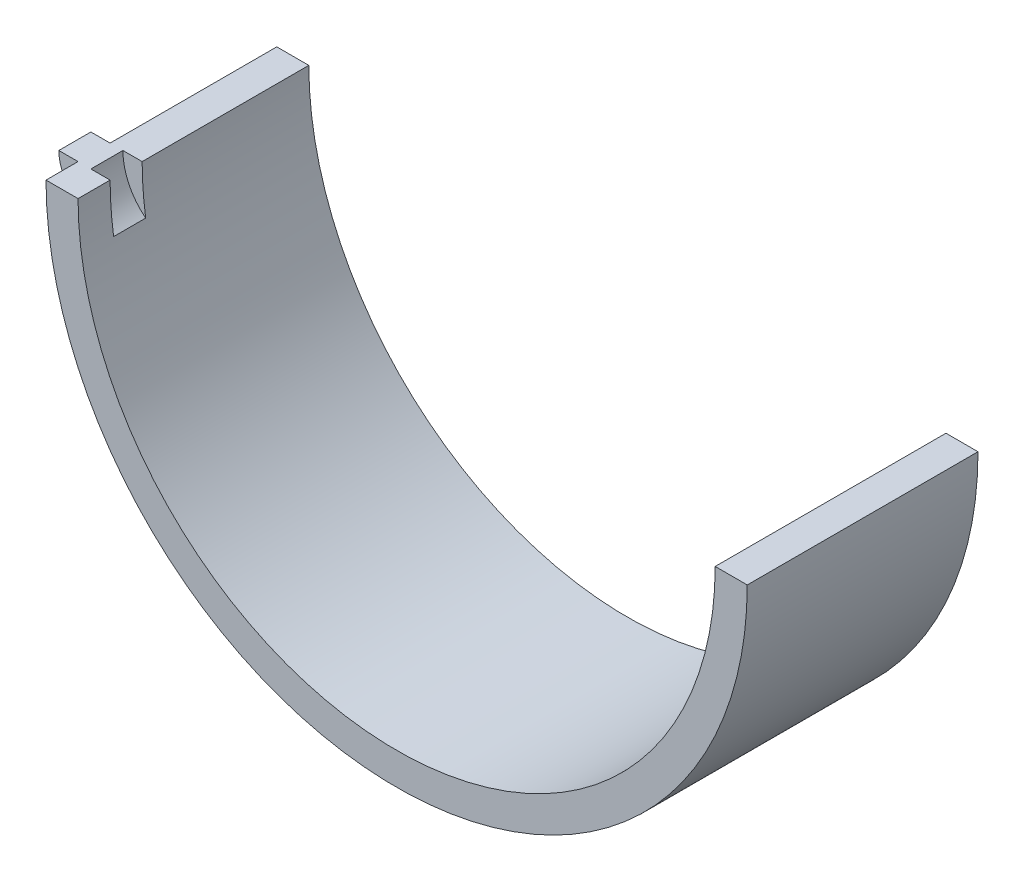
from build123d import *

# Parameters (mm, degrees)
BOSS_EXTRUDE1_DEPTH = 9.144
BOSS_EXTRUDE2_DEPTH = 1.27
CUT_EXTRUDE2_DEPTH  = 1.27


with BuildPart() as part:
    # Sketch1 → Boss-Extrude1 (new body)
    with BuildSketch(Plane.XY):
        with BuildLine():
            Line((13.8938, 13.8938), (12.6238, 13.8938))
            ThreePointArc((12.6238, 13.8938), (0, 1.27), (-12.6238, 13.8938))
            Line((-12.6238, 13.8938), (-13.8938, 13.8938))
            ThreePointArc((-13.8938, 13.8938), (0, 0), (13.8938, 13.8938))
        make_face()
    extrude(amount=-BOSS_EXTRUDE1_DEPTH)

    # Sketch3 → Boss-Extrude2 (add)
    with BuildSketch(Plane.XY.offset(-1.27)):
        with BuildLine():
            Line((-13.8938, 13.8938), (-14.6558, 13.8938))
            ThreePointArc((-14.6558, 13.8938), (-14.431944467, 13.081702502), (-13.82361054, 12.498998908))
            ThreePointArc((-13.82361054, 12.498998908), (-13.87624154, 13.19551699), (-13.8938, 13.8938))
        make_face()
    extrude(amount=-BOSS_EXTRUDE2_DEPTH)

    # Sketch4 → Cut-Extrude2 (cut)
    with BuildSketch(Plane.XY.offset(-1.27)):
        with BuildLine():
            Line((-13.3858, 13.8938), (-12.6238, 13.8938))
            ThreePointArc((-12.6238, 13.8938), (-12.588918043, 12.955999941), (-12.484464942, 12.023382522))
            ThreePointArc((-12.484464942, 12.023382522), (-13.148713609, 12.855668695), (-13.3858, 13.8938))
        make_face()
    extrude(amount=-CUT_EXTRUDE2_DEPTH, mode=Mode.SUBTRACT)


solid = part.part
